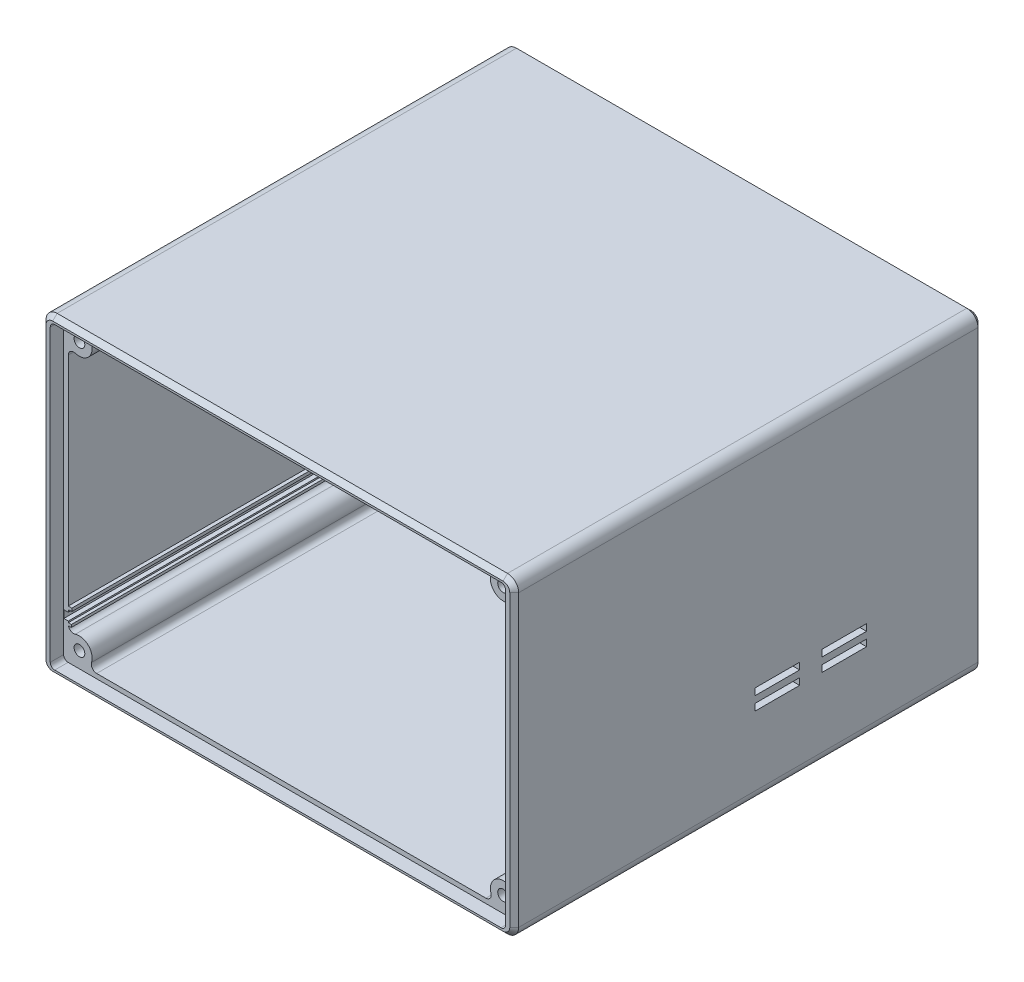
from build123d import *

# Parameters (mm, degrees)
SKETCH_3_W          = 106
SKETCH_3_H          = 105
EXTRUDE_1_DEPTH     = 70
SKETCH_4_W          = 100
SKETCH_4_H          = 65
CUT_EXTRUDE_1_DEPTH = 165.805946495
FILLET_2_R          = 2.5
FILLET_3_R          = 2.5
CHAMFER_1_SIZE      = 1
SKETCH_5_W          = 2.616772355
SKETCH_5_H          = 1.7
CUT_EXTRUDE_2_DEPTH = 165.805946495
SKETCH_7_W          = 102.1
SKETCH_7_H          = 67.1
CUT_EXTRUDE_3_DEPTH = 3
FILLET_4_R          = 1
SKETCH_8_W          = 102.1
SKETCH_8_H          = 67.1
CUT_EXTRUDE_4_DEPTH = 2
FILLET_5_R          = 1
SKETCH_9_R          = 2.9
EXTRUDE_2_DEPTH     = 100
FILLET_6_R          = 1.2
SKETCH_10_R         = 1.2
CUT_EXTRUDE_5_DEPTH = 163.911018657
SKETCH_11_W         = 10
SKETCH_11_H         = 1.5
CUT_EXTRUDE_6_DEPTH = 165.805946495
SKETCH_13_W         = 0.619617199
SKETCH_13_H         = 0.675027666
SKETCH_13_H_2       = 0.576636166
SKETCH_13_W_2       = 0.693795217
SKETCH_13_W_3       = 0.795649679
EXTRUDE_3_DEPTH     = 100


with BuildPart() as part:
    # 草图3 → 凸台-拉伸1 (new body)
    with BuildSketch(Plane(origin=(0, 0, 0), x_dir=(1, 0, 0), z_dir=(0, 1, 0))):
        with Locations((53, 52.5)):
            Rectangle(SKETCH_3_W, SKETCH_3_H)
    extrude(amount=EXTRUDE_1_DEPTH)

    # 草图4 → 切除-拉伸1 (cut, through all)
    with BuildSketch(Plane.XY):
        with Locations((53, 35)):
            Rectangle(SKETCH_4_W, SKETCH_4_H)
    extrude(amount=-CUT_EXTRUDE_1_DEPTH, mode=Mode.SUBTRACT)

    # 圆角2
    fillet_2_edges = [part.edges().sort_by_distance(p)[0] for p in [
        (106, 70, -52.5),
        (0, 70, -52.5),
        (106, 0, -52.5),
        (0, 0, -52.5),
    ]]
    fillet(fillet_2_edges, radius=FILLET_2_R)

    # 圆角3
    fillet_3_edges = [part.edges().sort_by_distance(p)[0] for p in [
        (3, 2.5, -52.5),
        (3, 67.5, -52.5),
        (103, 67.5, -52.5),
        (103, 2.5, -52.5),
    ]]
    fillet(fillet_3_edges, radius=FILLET_3_R)

    # 倒角1
    chamfer_1_edges = [part.edges().sort_by_distance(p)[0] for p in [
        (106, 35, -105),
        (106, 35, 0),
        (53, 0, -105),
        (0, 35, -105),
        (53, 70, -105),
        (0.732233047, 69.267766953, -105),
        (105.267766953, 69.267766953, -105),
        (0.732233047, 0.732233047, -105),
        (105.267766953, 0.732233047, -105),
        (53, 0, 0),
        (53, 70, 0),
        (0, 35, 0),
        (0.732233047, 69.267766953, 0),
        (105.267766953, 69.267766953, 0),
        (0.732233047, 0.732233047, 0),
        (105.267766953, 0.732233047, 0),
    ]]
    chamfer(chamfer_1_edges, length=CHAMFER_1_SIZE)

    # 草图5 → 切除-拉伸2 (cut, through all)
    with BuildSketch(Plane.XY):
        with Locations((3.308386178, 10.35)):
            Rectangle(SKETCH_5_W, SKETCH_5_H)
        with Locations((102.691613823, 10.35)):
            Rectangle(SKETCH_5_W, SKETCH_5_H)
    extrude(amount=-CUT_EXTRUDE_2_DEPTH, mode=Mode.SUBTRACT)

    # 草图7 → 切除-拉伸3 (cut)
    with BuildSketch(Plane.XY):
        with Locations((53, 35)):
            Rectangle(SKETCH_7_W, SKETCH_7_H)
    extrude(amount=-CUT_EXTRUDE_3_DEPTH, mode=Mode.SUBTRACT)

    # 圆角4
    fillet_4_edges = [part.edges().sort_by_distance(p)[0] for p in [
        (1.95, 1.45, -1.5),
        (1.95, 68.55, -1.5),
        (104.05, 68.55, -1.5),
        (104.05, 1.45, -1.5),
    ]]
    fillet(fillet_4_edges, radius=FILLET_4_R)

    # 草图8 → 切除-拉伸4 (cut)
    with BuildSketch(Plane(origin=(0, 0, -105), x_dir=(-1, 0, 0), z_dir=(0, 0, -1))):
        with Locations((-53, 35)):
            Rectangle(SKETCH_8_W, SKETCH_8_H)
    extrude(amount=-CUT_EXTRUDE_4_DEPTH, mode=Mode.SUBTRACT)

    # 圆角5
    fillet_5_edges = [part.edges().sort_by_distance(p)[0] for p in [
        (104.05, 1.45, -104),
        (104.05, 68.55, -104),
        (1.95, 68.55, -104),
        (1.95, 1.45, -104),
    ]]
    fillet(fillet_5_edges, radius=FILLET_5_R)

    # 草图9 → 凸台-拉伸2 (add)
    with BuildSketch(Plane.XY.offset(-3)):
        with Locations((5.45, 4.95)):
            Circle(SKETCH_9_R)
        with Locations((100.55, 4.95)):
            Circle(SKETCH_9_R)
        with Locations((100.55, 65.05)):
            Circle(SKETCH_9_R)
        with Locations((5.45, 65.05)):
            Circle(SKETCH_9_R)
    extrude(amount=-EXTRUDE_2_DEPTH)

    # 圆角6
    fillet_6_edges = [part.edges().sort_by_distance(p)[0] for p in [
        (3, 6.501612065, -53),
        (7.001612065, 2.5, -53),
        (103, 6.501612065, -53),
        (98.998387935, 2.5, -53),
        (98.998387935, 67.5, -53),
        (103, 63.498387935, -53),
        (3, 63.498387935, -53),
        (7.001612065, 67.5, -53),
    ]]
    fillet(fillet_6_edges, radius=FILLET_6_R)

    # 草图10 → 切除-拉伸5 (cut, through all)
    with BuildSketch(Plane.XY.offset(-3)):
        with Locations((5.5, 5)):
            Circle(SKETCH_10_R)
        with Locations((100.5, 65)):
            Circle(SKETCH_10_R)
        with Locations((5.5, 65)):
            Circle(SKETCH_10_R)
        with Locations((100.5, 5)):
            Circle(SKETCH_10_R)
    extrude(amount=-CUT_EXTRUDE_5_DEPTH, mode=Mode.SUBTRACT)

    # 草图11 → 切除-拉伸6 (cut, through all)
    with BuildSketch(Plane(origin=(106, 0, 0), x_dir=(0, 0, -1), z_dir=(1, 0, 0))):
        with Locations((74, 18.75)):
            Rectangle(SKETCH_11_W, SKETCH_11_H)
        with Locations((74, 21.75)):
            Rectangle(SKETCH_11_W, SKETCH_11_H)
        with Locations((59, 18.75)):
            Rectangle(SKETCH_11_W, SKETCH_11_H)
        with Locations((59, 21.75)):
            Rectangle(SKETCH_11_W, SKETCH_11_H)
    extrude(amount=-CUT_EXTRUDE_6_DEPTH, mode=Mode.SUBTRACT)

    # 草图13 → 凸台-拉伸3 (add)
    with BuildSketch(Plane.XY.offset(-3)):
        with Locations((102.6901914, 12.069011797)):
            Rectangle(SKETCH_13_W, SKETCH_13_H)
        with Locations((102.6901914, 8.889084283)):
            Rectangle(SKETCH_13_W, SKETCH_13_H_2)
        with Locations((3.346897608, 8.889084283)):
            Rectangle(SKETCH_13_W_2, SKETCH_13_H_2)
        with Locations((3.39782484, 12.069011797)):
            Rectangle(SKETCH_13_W_3, SKETCH_13_H)
    extrude(amount=-EXTRUDE_3_DEPTH)


solid = part.part
